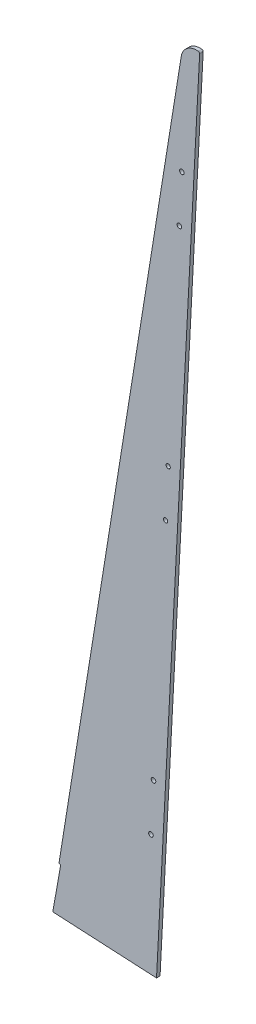
from build123d import *

# Parameters (mm, degrees)
BOSS_EXTRUDE1_DEPTH = 5
FILLET1_R           = 2
BOSS_EXTRUDE2_DEPTH = 5
BOSS_EXTRUDE3_DEPTH = 5
BOSS_EXTRUDE4_DEPTH = 5
CUT_EXTRUDE1_DEPTH  = 1184.176367894
SKETCH6_R           = 3.25
CUT_EXTRUDE2_DEPTH  = 1184.176367894
BOSS_EXTRUDE5_DEPTH = 5
CUT_EXTRUDE3_DEPTH  = 1184.176367894
SKETCH9_R           = 3
CUT_EXTRUDE4_DEPTH  = 1184.176367894


with BuildPart() as part:
    # Sketch1 → Boss-Extrude1 (new body)
    with BuildSketch(Plane.XY):
        Polygon((0, 0), (148, 0), (210.710741947, 1195), align=None)
    extrude(amount=BOSS_EXTRUDE1_DEPTH)

    # Fillet1
    fillet1_edges = [part.edges().sort_by_distance(p)[0] for p in [
        (210.710741947, 1195, 2.5),
    ]]
    fillet(fillet1_edges, radius=FILLET1_R)

    # Sketch2 → Boss-Extrude2 (add)
    with BuildSketch(Plane.XY.offset(5)):
        Polygon((191.942300905, 1088.558881537), (174.215761351, 1091.684548735), (10.318366476, 72.915290412), (12.780385859, 72.481169967), align=None)
    extrude(amount=-BOSS_EXTRUDE2_DEPTH)

    # Sketch3 → Boss-Extrude3 (add)
    with BuildSketch(Plane.XY.offset(5)):
        with BuildLine():
            Line((174.215761351, 1091.684548735), (182.955612005, 1146.010556635))
            ThreePointArc((182.955612005, 1146.010556635), (191.401570157, 1160.078122114), (207.225341391, 1164.418499006))
            ThreePointArc((207.225341391, 1164.418499006), (205.802244472, 1164.033891637), (205.029250268, 1162.778659534))
            Line((205.029250268, 1162.778659534), (191.942300905, 1088.558881537))
            Line((191.942300905, 1088.558881537), (174.215761351, 1091.684548735))
        make_face()
    extrude(amount=-BOSS_EXTRUDE3_DEPTH)

    # Sketch4 → Boss-Extrude4 (add)
    with BuildSketch(Plane.XY.offset(5)):
        Polygon((0, 0), (2.112629849, 11.981319257), (148.088309576, 1.682804887), (148, 0), align=None)
    extrude(amount=-BOSS_EXTRUDE4_DEPTH)

    # Sketch5 → Cut-Extrude1 (cut, through all)
    with BuildSketch(Plane.XY.offset(5)):
        Polygon((148.679280264, 12.9441925), (0.545384836, 3.093031107), (0, 0), (148, 0), align=None)
    extrude(amount=-CUT_EXTRUDE1_DEPTH, mode=Mode.SUBTRACT)

    # Sketch6 → Cut-Extrude2 (cut, through all)
    with BuildSketch(Plane.XY.offset(5)):
        with Locations((180.368599434, 937.514146328)):
            Circle(SKETCH6_R)
        with Locations((183.932173312, 1005.420706697)):
            Circle(SKETCH6_R)
        with Locations((143.832770259, 241.296648182)):
            Circle(SKETCH6_R)
        with Locations((140.269196381, 173.390087812)):
            Circle(SKETCH6_R)
    extrude(amount=-CUT_EXTRUDE2_DEPTH, mode=Mode.SUBTRACT)

    # Sketch7 → Boss-Extrude5 (add)
    with BuildSketch(Plane.XY.offset(5)):
        Polygon((148.679280264, 12.9441925), (148.090399515, 1.722630236), (54.104333141, 6.654794215), align=None)
    extrude(amount=-BOSS_EXTRUDE5_DEPTH)

    # Sketch8 → Cut-Extrude3 (cut, through all)
    with BuildSketch(Plane.XY.offset(5)):
        Polygon((54.104333141, 6.654794215), (1.658710562, 9.407015055), (0.545384836, 3.093031107), align=None)
    extrude(amount=-CUT_EXTRUDE3_DEPTH, mode=Mode.SUBTRACT)

    # Sketch9 → Cut-Extrude4 (cut, through all)
    with BuildSketch(Plane.XY.offset(5)):
        with Locations((160.968231329, 567.825650117)):
            Circle(SKETCH9_R)
        with Locations((164.531805206, 635.732210487)):
            Circle(SKETCH9_R)
    extrude(amount=-CUT_EXTRUDE4_DEPTH, mode=Mode.SUBTRACT)


solid = part.part
